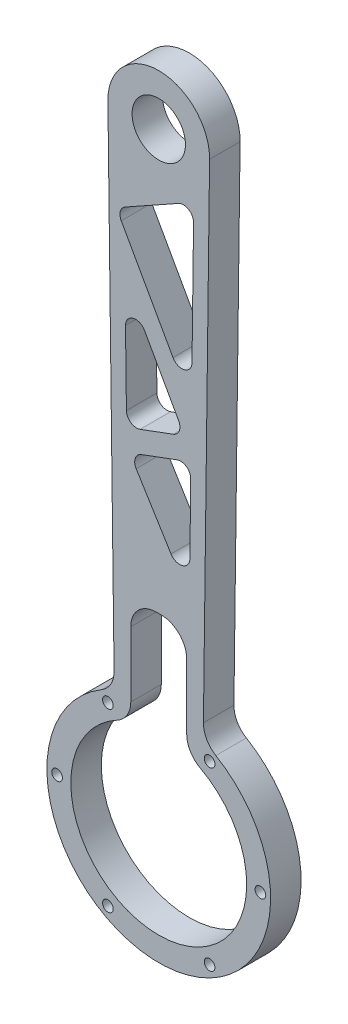
from build123d import *

# Parameters (mm, degrees)
EXTRUDE_1_DEPTH     = 12
SKETCH_2_R          = 10.5
SKETCH_2_R_2        = 34.6
SKETCH_2_R_3        = 2.1
CUT_EXTRUDE_1_DEPTH = 12
FILLET_1_R          = 10
SKETCH_3_W          = 22
SKETCH_3_H          = 50
CUT_EXTRUDE_2_DEPTH = 12
FILLET_2_R          = 10
CUT_EXTRUDE_3_DEPTH = 264.96969523
FILLET_4_R          = 4


with BuildPart() as part:
    # 草图1 → 凸台-拉伸1 (new body)
    with BuildSketch(Plane.XY):
        with BuildLine():
            Line((-17.5, 40.370162249), (-19.998429914, 239.749398802))
            ThreePointArc((-19.998429914, 239.749398802), (0, 260), (19.998429914, 239.749398802))
            Line((19.998429914, 239.749398802), (17.5, 40.370162249))
            ThreePointArc((17.5, 40.370162249), (0, -44), (-17.5, 40.370162249))
        make_face()
    extrude(amount=EXTRUDE_1_DEPTH)

    # 草图2 → 切除-拉伸1 (cut)
    with BuildSketch(Plane.XY.offset(12)):
        with Locations((0, 240)):
            Circle(SKETCH_2_R)
        Circle(SKETCH_2_R_2)
        with Locations((20, 34.641016151)):
            Circle(SKETCH_2_R_3)
        with Locations((40, 0)):
            Circle(SKETCH_2_R_3)
        with Locations((20, -34.641016151)):
            Circle(SKETCH_2_R_3)
        with Locations((-20, -34.641016151)):
            Circle(SKETCH_2_R_3)
        with Locations((-40, 0)):
            Circle(SKETCH_2_R_3)
        with Locations((-20, 34.641016151)):
            Circle(SKETCH_2_R_3)
    extrude(amount=-CUT_EXTRUDE_1_DEPTH, mode=Mode.SUBTRACT)

    # 圆角1
    fillet_1_edges = [part.edges().sort_by_distance(p)[0] for p in [
        (-17.5, 40.370162249, 6),
        (17.5, 40.370162249, 6),
    ]]
    fillet(fillet_1_edges, radius=FILLET_1_R)

    # 草图3 → 切除-拉伸2 (cut)
    with BuildSketch(Plane(origin=(0, 0, 0), x_dir=(-1, 0, 0), z_dir=(0, 0, -1))):
        with Locations((0, 50)):
            Rectangle(SKETCH_3_W, SKETCH_3_H)
    extrude(amount=-CUT_EXTRUDE_2_DEPTH, mode=Mode.SUBTRACT)

    # 圆角2
    fillet_2_edges = [part.edges().sort_by_distance(p)[0] for p in [
        (-11, 32.804877686, 6),
        (11, 32.804877686, 6),
        (-11, 75, 6),
        (11, 75, 6),
    ]]
    fillet(fillet_2_edges, radius=FILLET_2_R)

    # 草图5 → 切除-拉伸3 (cut, through all)
    with BuildSketch(Plane(origin=(0, 0, 0), x_dir=(-1, 0, 0), z_dir=(0, 0, -1))):
        Polygon((-13.775012743, 221.957895182), (16.705979035, 204.93348865), (-12.897497215, 151.930565202), align=None)
        Polygon((13.279210594, 182.391984789), (-10.08410037, 140.561634461), (12.649095231, 132.107636495), align=None)
        Polygon((-12.660080973, 132.98431864), (11.431866329, 124.025029456), (-12.071548884, 86.018390981), align=None)
    extrude(amount=-CUT_EXTRUDE_3_DEPTH, mode=Mode.SUBTRACT)

    # 圆角4
    fillet_4_edges = [part.edges().sort_by_distance(p)[0] for p in [
        (-13.279210594, 182.391984789, 6),
        (-12.649095231, 132.107636495, 6),
        (10.08410037, 140.561634461, 6),
        (12.071548884, 86.018390981, 6),
        (12.660080973, 132.98431864, 6),
        (-11.431866329, 124.025029456, 6),
        (12.897497215, 151.930565202, 6),
        (13.775012743, 221.957895182, 6),
        (-16.705979035, 204.93348865, 6),
    ]]
    fillet(fillet_4_edges, radius=FILLET_4_R)


solid = part.part
